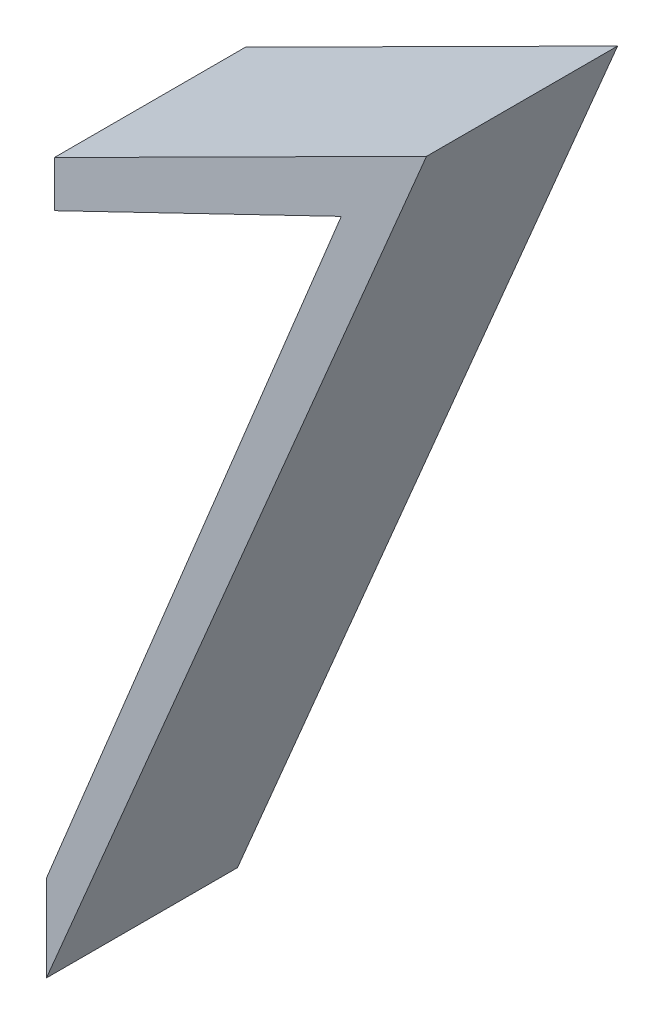
from build123d import *

# Parameters (mm, degrees)
BOSS_EXTRUDE1_DEPTH = 5


with BuildPart() as part:
    # Sketch1 → Boss-Extrude1 (new body)
    with BuildSketch(Plane.XY):
        Polygon((-6.811917138, 24.428036834), (2.9251791, 29.323462032), (-7.020454333, 5.732734115), (-7.020454333, 7.993916764), (0.695985399, 26.848304899), (-6.811917138, 23.223438247), align=None)
    extrude(amount=BOSS_EXTRUDE1_DEPTH)


solid = part.part
